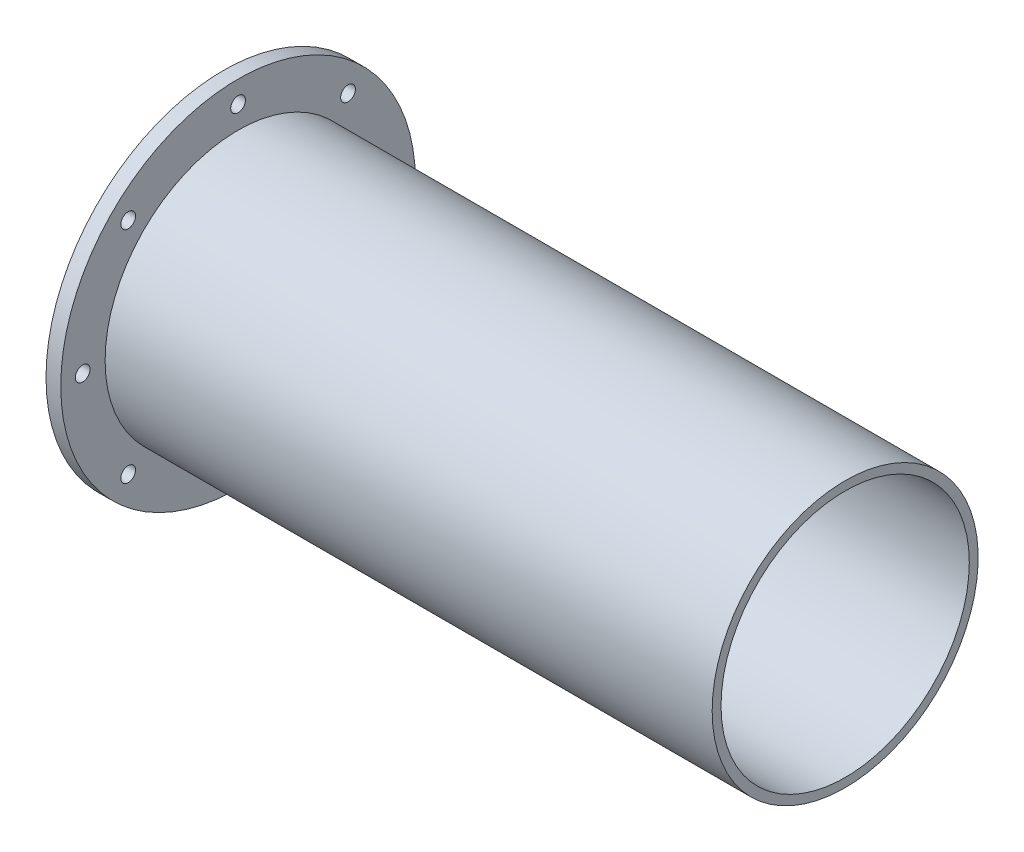
from build123d import *

# Parameters (mm, degrees)
SKETCH2_R          = 3.175
CUT_EXTRUDE1_DEPTH = 283.24063521
CIRPATTERN1_COUNT  = 8


with BuildPart() as part:
    # Sketch1 → Revolve1 (revolve)
    with BuildSketch(Plane.XY, mode=Mode.PRIVATE) as revolve1_sk:
        Polygon((0, 76.2), (6.35, 76.2), (6.35, 57.15), (267.208, 57.15), (267.208, 53.34), (0, 53.34), align=None)
    revolve(revolve1_sk.sketch.rotate(Axis((0, 0, 0), (1, 0, 0)), 90), axis=Axis((0, 0, 0), (1, 0, 0)))

    # Sketch2 → Cut-Extrude1 (cut, through all)
    with BuildSketch(Plane(origin=(6.35, 0, 0), x_dir=(0, 0, -1), z_dir=(1, 0, 0))):
        with Locations((66.802, 0)):
            Circle(SKETCH2_R)
    cut_extrude1 = extrude(amount=-CUT_EXTRUDE1_DEPTH, mode=Mode.SUBTRACT)

    # CirPattern1: Cut-Extrude1 ×8 about axis
    cirpattern1_axis = Axis((0, 0, 0), (1, 0, 0))
    for i in range(1, CIRPATTERN1_COUNT):
        add(cut_extrude1.rotate(cirpattern1_axis, i * 360 / CIRPATTERN1_COUNT), mode=Mode.SUBTRACT)


solid = part.part
